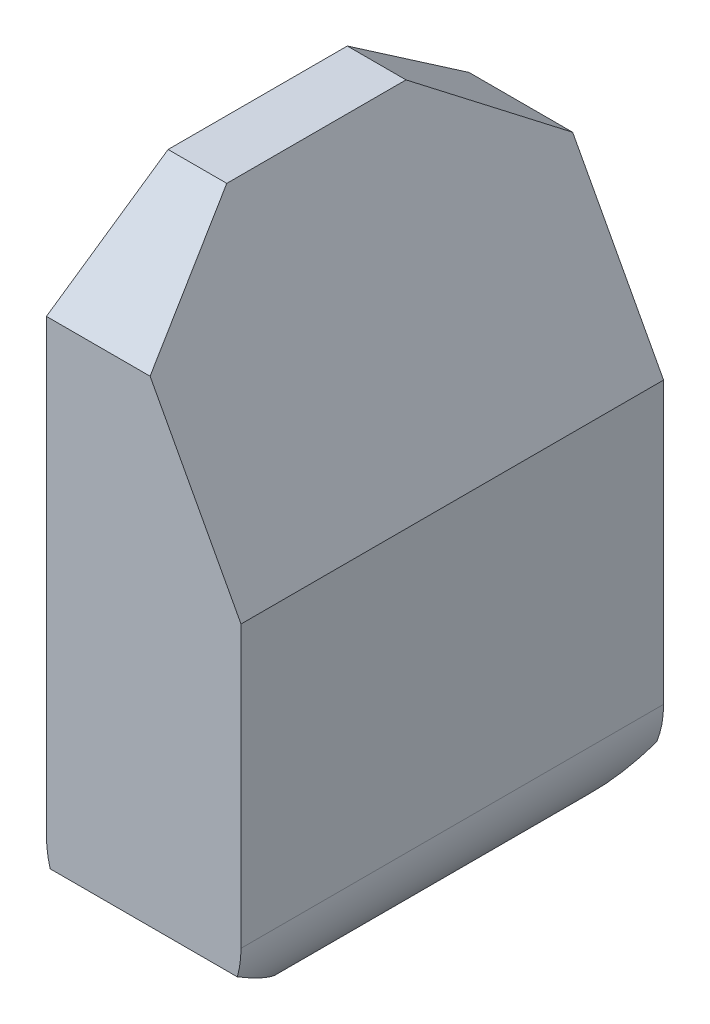
from build123d import *

# Parameters (mm, degrees)
BOSS_EXTRUDE1_DEPTH      = 30.956
BOSS_EXTRUDE1_DEPTH_BACK = 2
CUT_EXTRUDE1_DEPTH       = 50.013690395
CUT_EXTRUDE1_DEPTH_BACK  = 50.013690395


with BuildPart() as part:
    # Sketch1 → Boss-Extrude1 (new, two sides: drawn at the far end of the back side and taken through both)
    with BuildSketch(Plane.XY.offset(-BOSS_EXTRUDE1_DEPTH_BACK)):
        with BuildLine():
            Line((-3.6, 36.195), (-3.6, -5.427367667))
            ThreePointArc((-3.6, -5.427367667), (3.9877, -13.015067667), (11.5754, -5.427367667))
            Line((11.5754, -5.427367667), (11.5754, 16.475329119))
            Line((11.5754, 16.475329119), (0.976429971, 36.195))
            Line((0.976429971, 36.195), (-3.6, 36.195))
        make_face()
    extrude(amount=BOSS_EXTRUDE1_DEPTH + BOSS_EXTRUDE1_DEPTH_BACK)

    # Sketch2 → Cut-Extrude1 (cut, two sides: drawn at the far end of the back side and taken through both)
    with BuildSketch(Plane.ZY.offset(-CUT_EXTRUDE1_DEPTH_BACK)):
        Polygon((-2, 29.667962996), (7.4890837, 36.195), (21.4669163, 36.195), (30.956, 29.667962996), (30.956, 40.573926282), (-2, 40.573926282), align=None)
        Polygon((-6.302377798, -4.81069075), (9.259609163, -17.017997888), (16.714453216, -17.017997888), (37.494831014, -3.133350838), (37.494831014, -21.39692417), (-6.302377798, -21.39692417), align=None)
    extrude(amount=CUT_EXTRUDE1_DEPTH + CUT_EXTRUDE1_DEPTH_BACK, mode=Mode.SUBTRACT)


solid = part.part
